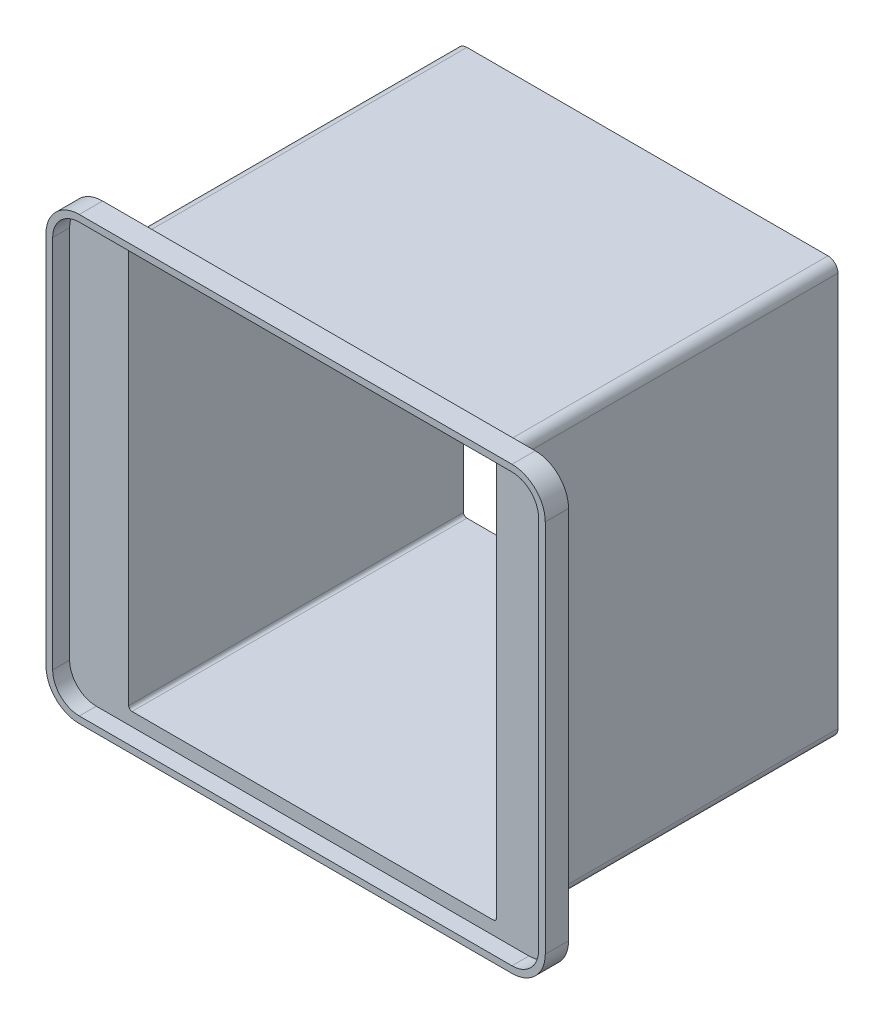
from build123d import *

# Parameters (mm, degrees)
BOSS_EXTRUDE1_DEPTH = 98.705
BOSS_EXTRUDE2_START = 7
SKETCH5_W           = 150
SKETCH5_H           = 132.5
BOSS_EXTRUDE2_DEPTH = 7
FILLET1_R           = 10
CUT_EXTRUDE1_DEPTH  = 5.099


with BuildPart() as part:
    # Sketch1 → Boss-Extrude1 (new body)
    with BuildSketch(Plane.XY):
        with BuildLine():
            Line((-54.25, 62.25), (54.25, 62.25))
            ThreePointArc((54.25, 62.25), (56.371320344, 61.371320344), (57.25, 59.25))
            Line((57.25, 59.25), (57.25, -59.25))
            ThreePointArc((57.25, -59.25), (56.371320344, -61.371320344), (54.25, -62.25))
            Line((54.25, -62.25), (-54.25, -62.25))
            ThreePointArc((-54.25, -62.25), (-56.371320344, -61.371320344), (-57.25, -59.25))
            Line((-57.25, -59.25), (-57.25, 59.25))
            ThreePointArc((-57.25, 59.25), (-56.371320344, 61.371320344), (-54.25, 62.25))
        make_face()
        with BuildLine():
            Line((-55.25, 59.25), (-55.25, -59.25))
            ThreePointArc((-55.25, -59.25), (-54.957106781, -59.957106781), (-54.25, -60.25))
            Line((-54.25, -60.25), (54.25, -60.25))
            ThreePointArc((54.25, -60.25), (54.957106781, -59.957106781), (55.25, -59.25))
            Line((55.25, -59.25), (55.25, 59.25))
            ThreePointArc((55.25, 59.25), (54.957106781, 59.957106781), (54.25, 60.25))
            Line((54.25, 60.25), (-54.25, 60.25))
            ThreePointArc((-54.25, 60.25), (-54.957106781, 59.957106781), (-55.25, 59.25))
        make_face(mode=Mode.SUBTRACT)
    extrude(amount=-BOSS_EXTRUDE1_DEPTH)

    # Sketch5 → Boss-Extrude2 (add)
    with BuildSketch(Plane.XY.offset(BOSS_EXTRUDE2_START)):
        Rectangle(SKETCH5_W, SKETCH5_H)
        with BuildLine():
            Line((-54.25, -60.25), (54.25, -60.25))
            ThreePointArc((54.25, -60.25), (54.957106781, -59.957106781), (55.25, -59.25))
            Line((55.25, -59.25), (55.25, 59.25))
            ThreePointArc((55.25, 59.25), (54.957106781, 59.957106781), (54.25, 60.25))
            Line((54.25, 60.25), (-54.25, 60.25))
            ThreePointArc((-54.25, 60.25), (-54.957106781, 59.957106781), (-55.25, 59.25))
            Line((-55.25, 59.25), (-55.25, -59.25))
            ThreePointArc((-55.25, -59.25), (-54.957106781, -59.957106781), (-54.25, -60.25))
        make_face(mode=Mode.SUBTRACT)
    extrude(amount=-BOSS_EXTRUDE2_DEPTH)

    # Fillet1
    fillet1_edges = [part.edges().sort_by_distance(p)[0] for p in [
        (-75, 66.25, 3.5),
        (-75, -66.25, 3.5),
        (75, -66.25, 3.5),
        (75, 66.25, 3.5),
    ]]
    fillet(fillet1_edges, radius=FILLET1_R)

    # Sketch6 → Cut-Extrude1 (cut)
    with BuildSketch(Plane.XY.offset(7)):
        with BuildLine():
            Line((73, -56.25), (73, 56.25))
            ThreePointArc((73, 56.25), (70.656854249, 61.906854249), (65, 64.25))
            Line((65, 64.25), (-65, 64.25))
            ThreePointArc((-65, 64.25), (-70.656854249, 61.906854249), (-73, 56.25))
            Line((-73, 56.25), (-73, -56.25))
            ThreePointArc((-73, -56.25), (-70.656854249, -61.906854249), (-65, -64.25))
            Line((-65, -64.25), (65, -64.25))
            ThreePointArc((65, -64.25), (70.656854249, -61.906854249), (73, -56.25))
        make_face()
    extrude(amount=-CUT_EXTRUDE1_DEPTH, mode=Mode.SUBTRACT)


solid = part.part
